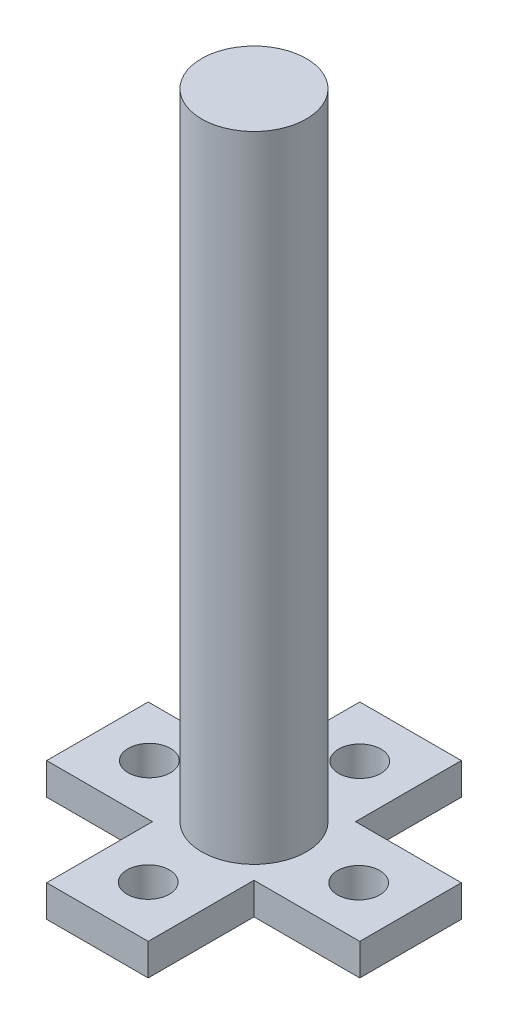
from build123d import *

# Parameters (mm, degrees)
SKETCH_1_W          = 10
SKETCH_1_H          = 9.6
SKETCH_1_R          = 2
SKETCH_1_W_2        = 9.6
SKETCH_1_H_2        = 10
SKETCH_1_R_2        = 4
EXTRUDE_2_DEPTH     = 3
SKETCH_2_R          = 3.95
EXTRUDE_3_DEPTH     = 120
CUT_EXTRUDE_START   = -60
SKETCH_3_R          = 3.95
CUT_EXTRUDE_1_DEPTH = 60
SKETCH_4_R          = 4.95
EXTRUDE_4_DEPTH     = 60


with BuildPart() as part:
    # 草图1 → 凸台-拉伸2 (new body)
    # profile 1 of 6: a face of its own
    with BuildSketch(Plane(origin=(0, 0, 0), x_dir=(1, 0, 0), z_dir=(0, 1, 0))):
        with Locations((-9.8, 0)):
            Rectangle(SKETCH_1_W, SKETCH_1_H)
        with Locations(Location((-9.946440474, 0.053559526, 0), (0, 0, 270))):
            Circle(SKETCH_1_R, mode=Mode.SUBTRACT)
    # profile 2 of 6: a face of its own
    with BuildSketch(Plane(origin=(0, 0, 0), x_dir=(1, 0, 0), z_dir=(0, 1, 0))):
        with Locations((0, -9.8)):
            Rectangle(SKETCH_1_W_2, SKETCH_1_H_2)
        with Locations(Location((-0.053559526, -9.946440474, 0), (0, 0, 270))):
            Circle(SKETCH_1_R, mode=Mode.SUBTRACT)
    # profile 3 of 6: a face of its own
    with BuildSketch(Plane(origin=(0, 0, 0), x_dir=(1, 0, 0), z_dir=(0, 1, 0))):
        Rectangle(SKETCH_1_W_2, SKETCH_1_H)
        Circle(SKETCH_1_R_2, mode=Mode.SUBTRACT)
    # profile 4 of 6: a face of its own
    with BuildSketch(Plane(origin=(0, 0, 0), x_dir=(1, 0, 0), z_dir=(0, 1, 0))):
        with Locations((9.8, 0)):
            Rectangle(SKETCH_1_W, SKETCH_1_H)
        with Locations(Location((9.946440474, -0.053559526, 0), (0, 0, 270))):
            Circle(SKETCH_1_R, mode=Mode.SUBTRACT)
    # profile 5 of 6: a face of its own
    with BuildSketch(Plane(origin=(0, 0, 0), x_dir=(1, 0, 0), z_dir=(0, 1, 0))):
        with Locations((0, 9.8)):
            Rectangle(SKETCH_1_W_2, SKETCH_1_H_2)
        with Locations(Location((0.053559526, 9.946440474, 0), (0, 0, 270))):
            Circle(SKETCH_1_R, mode=Mode.SUBTRACT)
    # profile 6 of 6: a face of its own
    with BuildSketch(Plane(origin=(0, 0, 0), x_dir=(1, 0, 0), z_dir=(0, 1, 0))):
        Circle(SKETCH_1_R_2)
    extrude(amount=EXTRUDE_2_DEPTH)

    # 草图2 → 凸台-拉伸3 (add)
    with BuildSketch(Plane(origin=(0, 3, 0), x_dir=(1, 0, 0), z_dir=(0, 1, 0))):
        with Locations(Location((0, 0, 0), (0, 0, 270))):
            Circle(SKETCH_2_R)
    extrude(amount=EXTRUDE_3_DEPTH)

    # 草图3 → 切除-拉伸1 (cut)
    with BuildSketch(Plane(origin=(0, 123, 0), x_dir=(1, 0, 0), z_dir=(0, 1, 0)).offset(CUT_EXTRUDE_START)):
        with Locations(Location((0, 0, 0), (0, 0, 270))):
            Circle(SKETCH_3_R)
    extrude(amount=CUT_EXTRUDE_1_DEPTH, mode=Mode.SUBTRACT)

    # 草图4 → 凸台-拉伸4 (add)
    with BuildSketch(Plane(origin=(0, 63, 0), x_dir=(1, 0, 0), z_dir=(0, 1, 0))):
        with Locations(Location((0, 0, 0), (0, 0, 270))):
            Circle(SKETCH_4_R)
    extrude(amount=-EXTRUDE_4_DEPTH)


solid = part.part
